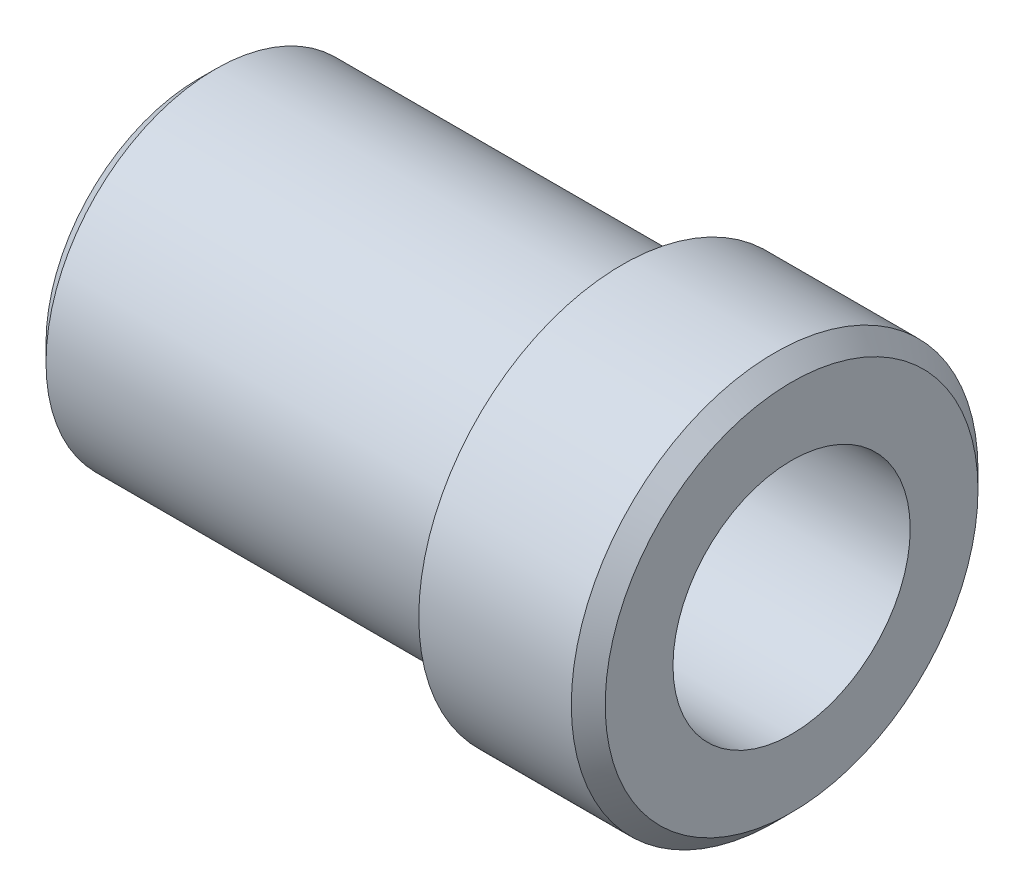
from build123d import *

# Parameters (mm, degrees)
CHAMFER1_SIZE = 1


with BuildPart() as part:
    # Sketch1 → Revolve1 (revolve)
    with BuildSketch(Plane.XY, mode=Mode.PRIVATE) as revolve1_sk:
        Polygon((0, 7), (0, 12), (-10, 12), (-10, 10), (-35, 10), (-35, 7), align=None)
    revolve(revolve1_sk.sketch.rotate(Axis((0, 0, 0), (-1, 0, 0)), 90), axis=Axis((0, 0, 0), (-1, 0, 0)))

    # Chamfer1
    chamfer1_edges = [part.edges().sort_by_distance(p)[0] for p in [
        (-35, 0, 10),
        (0, 0, 12),
    ]]
    chamfer(chamfer1_edges, length=CHAMFER1_SIZE)


solid = part.part
